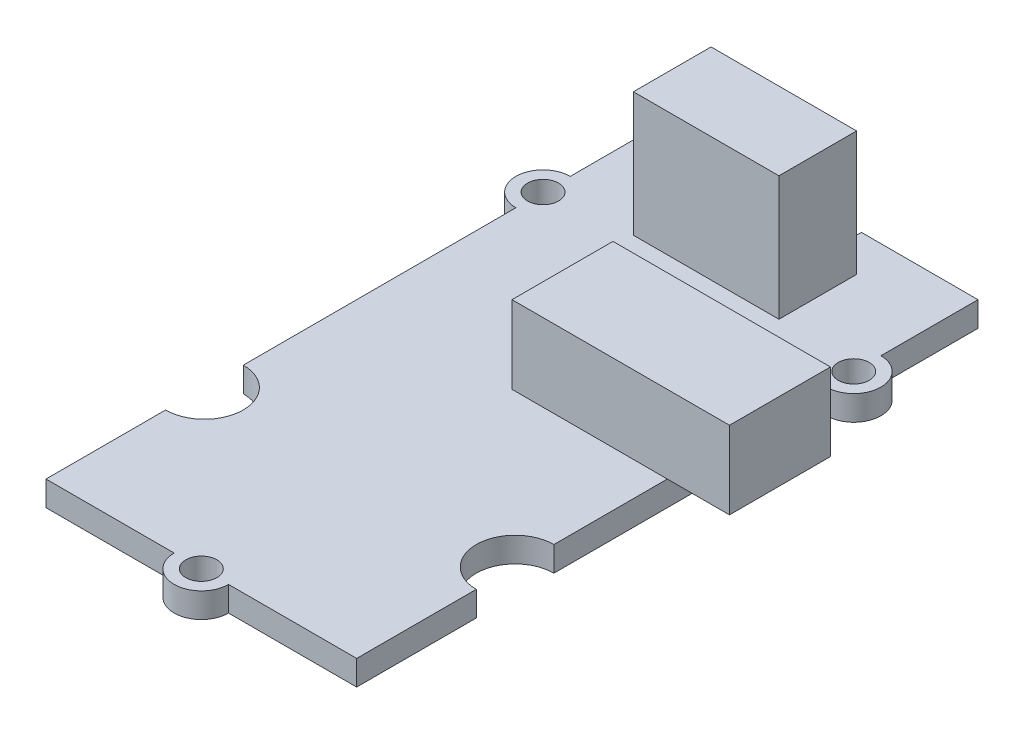
from build123d import *

# Parameters (mm, degrees)
SKETCH1_R                 = 1
PCB_DEPTH                 = 1.6
SKETCH2_W                 = 14
SKETCH2_H                 = 6.5
ELECTRODE_CONNECTOR_DEPTH = 5
SKETCH2_3_W               = 9.369035826
SKETCH2_3_H               = 5
CONTROL_CONNECTOR_DEPTH   = 8


with BuildPart() as part:
    # Sketch1 → PCB (new body)
    with BuildSketch(Plane(origin=(0, 0, 0), x_dir=(1, 0, 0), z_dir=(0, 1, 0))):
        with BuildLine():
            ThreePointArc((-1.75, -20), (0, -21.75), (1.75, -20))
            Line((1.75, -20), (10, -20))
            Line((10, -20), (10, -12.3))
            ThreePointArc((10, -12.3), (7.5, -9.8), (10, -7.3))
            Line((10, -7.3), (10, 10.25))
            ThreePointArc((10, 10.25), (11.75, 12), (10, 13.75))
            Line((10, 13.75), (10, 20))
            Line((10, 20), (2.5, 20))
            ThreePointArc((2.5, 20), (0, 17.5), (-2.5, 20))
            Line((-2.5, 20), (-10, 20))
            Line((-10, 20), (-10, 13.75))
            ThreePointArc((-10, 13.75), (-11.75, 12), (-10, 10.25))
            Line((-10, 10.25), (-10, -7.3))
            ThreePointArc((-10, -7.3), (-7.5, -9.8), (-10, -12.3))
            Line((-10, -12.3), (-10, -20))
            Line((-10, -20), (-1.75, -20))
        make_face()
        with Locations((0, -20)):
            Circle(SKETCH1_R, mode=Mode.SUBTRACT)
        with Locations((-10, 12)):
            Circle(SKETCH1_R, mode=Mode.SUBTRACT)
        with Locations((10, 12)):
            Circle(SKETCH1_R, mode=Mode.SUBTRACT)
    extrude(amount=PCB_DEPTH)

    # Sketch2 → Electrode_connector (add)
    with BuildSketch(Plane(origin=(0, 1.6, 0), x_dir=(1, 0, 0), z_dir=(0, 1, 0))):
        with Locations((7, 3.25)):
            Rectangle(SKETCH2_W, SKETCH2_H)
    extrude(amount=ELECTRODE_CONNECTOR_DEPTH)

    # Sketch2<3> → Control_connector (add)
    with BuildSketch(Plane(origin=(0, 1.6, 0), x_dir=(1, 0, 0), z_dir=(0, 1, 0))):
        with Locations((0, 15)):
            Rectangle(SKETCH2_3_W, SKETCH2_3_H)
    extrude(amount=CONTROL_CONNECTOR_DEPTH)


solid = part.part
